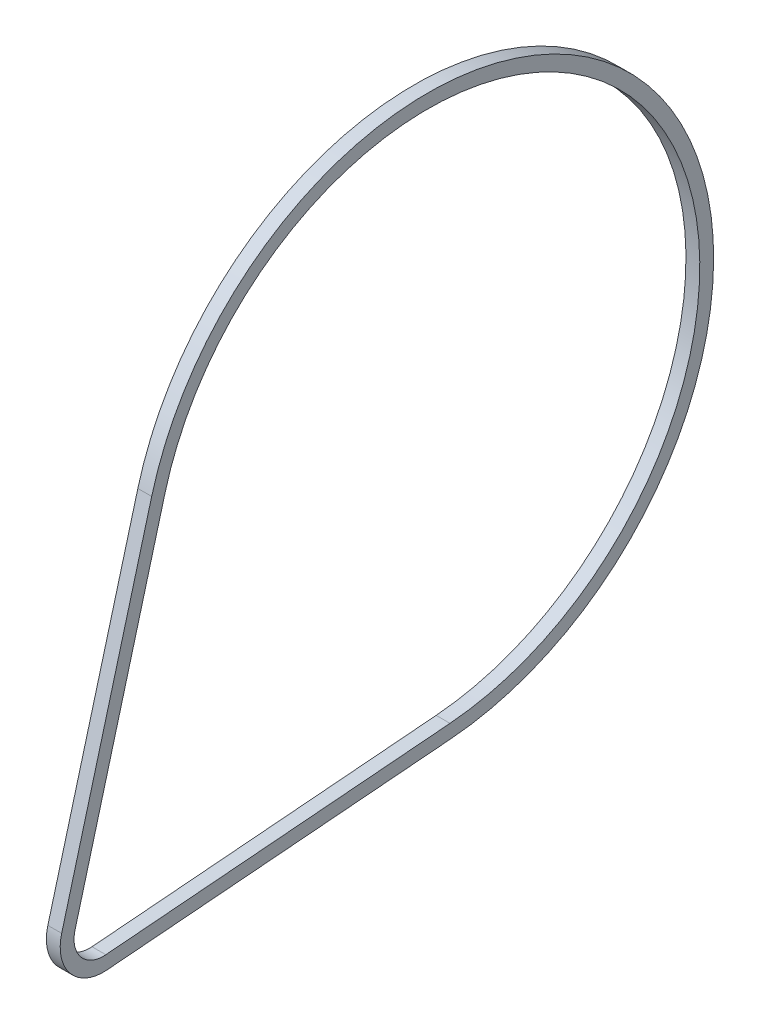
from build123d import *

# Parameters (mm, degrees)
BOSS_EXTRUDE1_DEPTH = 5.08


with BuildPart() as part:
    # Sketch1 → Boss-Extrude1 (new body)
    with BuildSketch(Plane(origin=(0, 0, 0), x_dir=(0, 0, -1), z_dir=(1, 0, 0))):
        with BuildLine():
            Line((120.586998924, 167.137640487), (87.539682399, 44.700154532))
            ThreePointArc((87.539682399, 44.700154532), (90.669108817, 30.402323035), (104.166458591, 24.741683115))
            Line((104.166458591, 24.741683115), (230.559376885, 35.128853164))
            ThreePointArc((230.559376885, 35.128853164), (302.63303962, 206.982821842), (120.586998924, 167.137640487))
        make_face()
        with BuildLine():
            Line((125.491487564, 165.813861358), (92.444171039, 43.376375403))
            ThreePointArc((92.444171039, 43.376375403), (94.572181003, 33.653849985), (103.75037885, 29.80461484))
            Line((103.75037885, 29.80461484), (230.143297144, 40.191784889))
            ThreePointArc((230.143297144, 40.191784889), (298.729967434, 203.731294892), (125.491487564, 165.813861358))
        make_face(mode=Mode.SUBTRACT)
    extrude(amount=BOSS_EXTRUDE1_DEPTH)


solid = part.part
